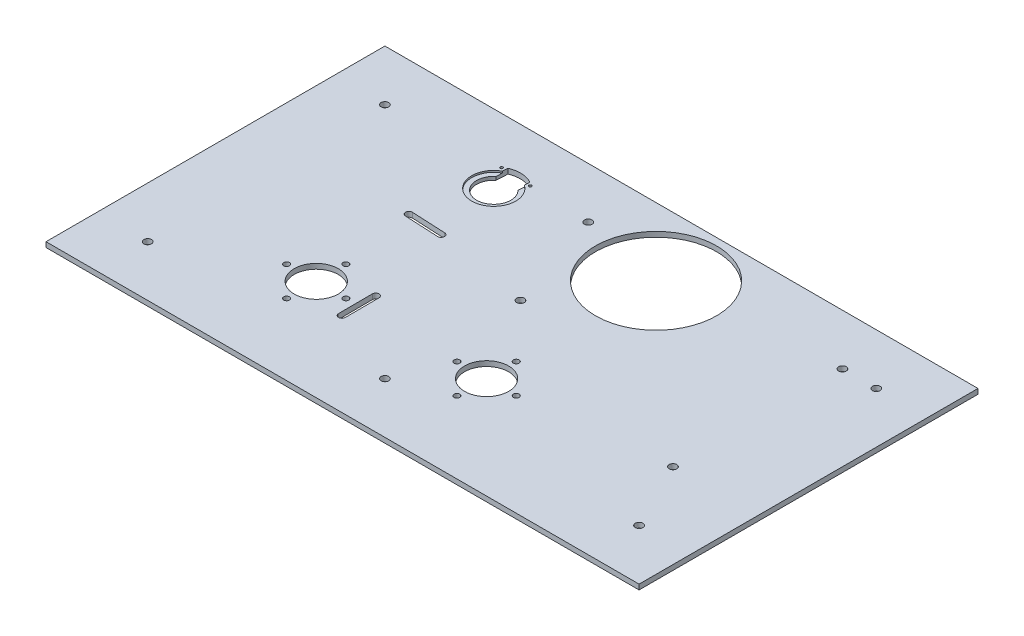
from build123d import *

# Parameters (mm, degrees)
SKETCH1_W                = 200
SKETCH1_H                = 200
BOSS_EXTRUDE1_DEPTH      = 3
SKETCH2_R                = 13
SKETCH2_R_2              = 35.7386452
SKETCH2_R_3              = 0.8
CUT_EXTRUDE1_DEPTH       = 283.85862193
M3_CLEARANCE_HOLE1_D     = 3.4
SKETCH5_R                = 13
CUT_EXTRUDE2_DEPTH       = 1
SKETCH6_W                = 50
SKETCH6_H                = 200
SKETCH6_W_2              = 100
BOSS_EXTRUDE2_DEPTH      = 3
M4_CLEARANCE_HOLE1_D     = 4.5
M4_CLEARANCE_HOLE1_DEPTH = 7
M4_CLEARANCE_HOLE1_TIP   = 1.351936393
M4_CLEARANCE_HOLE2_D     = 4.5
M4_CLEARANCE_HOLE2_DEPTH = 7
M4_CLEARANCE_HOLE2_TIP   = 1.351936393


with BuildPart() as part:
    # Sketch1 → Boss-Extrude1 (new body)
    with BuildSketch(Plane(origin=(0, 0, 0), x_dir=(1, 0, 0), z_dir=(0, 1, 0))):
        with Locations((100, 100)):
            Rectangle(SKETCH1_W, SKETCH1_H)
    extrude(amount=BOSS_EXTRUDE1_DEPTH)

    # Sketch2 → Cut-Extrude1 (cut, through all)
    with BuildSketch(Plane(origin=(0, 3, 0), x_dir=(1, 0, 0), z_dir=(0, 1, 0))):
        with Locations(Location((50.001332131, 59.483836796, 0), (0, 0, 270))):
            Circle(SKETCH2_R)
        with Locations(Location((150, 60, 0), (0, 0, 270))):
            Circle(SKETCH2_R)
        with Locations(Location((150, 160, 0), (0, 0, 270))):
            Circle(SKETCH2_R_2)
        with Locations(Location((46.591949224, 172.263872743, 0), (0, 0, 270))):
            Circle(SKETCH2_R_3)
        with Locations(Location((64.370811118, 171.396653192, 0), (0, 0, 90))):
            Circle(SKETCH2_R_3)
        with BuildLine():
            Line((73.052642061, 49.602687546), (72.949409421, 69.60242112))
            ThreePointArc((72.949409421, 69.60242112), (74.939059514, 71.612717742), (76.949356135, 69.623067648))
            Line((76.949356135, 69.623067648), (77.052588776, 49.623334074))
            ThreePointArc((77.052588776, 49.623334074), (75.062938683, 47.613037453), (73.052642061, 49.602687546))
        make_face()
        with BuildLine():
            Line((62.029703942, 166.504903281), (62.354703913, 173.16772538))
            ThreePointArc((62.354703913, 173.16772538), (55.639330891, 175.068409569), (48.770854376, 173.830320093))
            Line((48.770854376, 173.830320093), (48.445854405, 167.167497995))
            ThreePointArc((48.445854405, 167.167497995), (54.380843153, 149.268161339), (62.029703942, 166.504903281))
        make_face()
        with BuildLine():
            Line((62.877372778, 118.201780064), (42.901123459, 119.176184054))
            ThreePointArc((42.901123459, 119.176184054), (41.000938926, 121.271249385), (43.096004257, 123.171433918))
            Line((43.096004257, 123.171433918), (63.072253576, 122.197029928))
            ThreePointArc((63.072253576, 122.197029928), (64.972438109, 120.101964597), (62.877372778, 118.201780064))
        make_face()
    extrude(amount=-CUT_EXTRUDE1_DEPTH, mode=Mode.SUBTRACT)

    # M3 Clearance Hole1 (through all)
    with Locations(Plane(origin=(0, 3, 0), x_dir=(1, 0, 0), z_dir=(0, 1, 0))):
        with Locations((132.5, 60), (150, 77.5), (150, 42.5), (167.5, 60), (50.001332131, 76.983836796), (50.001332131, 41.983836796), (67.501332131, 59.483836796), (32.501332131, 59.483836796)):
            Hole(M3_CLEARANCE_HOLE1_D / 2)

    # Sketch5 → Cut-Extrude2 (cut)
    with BuildSketch(Plane(origin=(0, 3, 0), x_dir=(1, 0, 0), z_dir=(0, 1, 0))):
        with Locations((54.873352081, 159.365083393)):
            Circle(SKETCH5_R)
    extrude(amount=-CUT_EXTRUDE2_DEPTH, mode=Mode.SUBTRACT)

    # Sketch6 → Boss-Extrude2 (add)
    with BuildSketch(Plane(origin=(0, 3, 0), x_dir=(1, 0, 0), z_dir=(0, 1, 0))):
        with Locations((-25, 100)):
            Rectangle(SKETCH6_W, SKETCH6_H)
        with Locations((250, 100)):
            Rectangle(SKETCH6_W_2, SKETCH6_H)
    extrude(amount=-BOSS_EXTRUDE2_DEPTH)

    # M4 Clearance Hole1
    with Locations(Plane(origin=(0, 3, 0), x_dir=(1, 0, 0), z_dir=(0, 1, 0))):
        with Locations((100, 170), (250, 170), (250, 70)):
            Hole(M4_CLEARANCE_HOLE1_D / 2, depth=M4_CLEARANCE_HOLE1_DEPTH)
            with Locations((0, 0, -(M4_CLEARANCE_HOLE1_DEPTH + M4_CLEARANCE_HOLE1_TIP / 2))):  # 118° drill point
                Cone(0, M4_CLEARANCE_HOLE1_D / 2, M4_CLEARANCE_HOLE1_TIP, mode=Mode.SUBTRACT)

    # M4 Clearance Hole2
    with Locations(Plane(origin=(0, 3, 0), x_dir=(1, 0, 0), z_dir=(0, 1, 0))):
        with Locations((-20, 30), (270, 30), (-20, 170), (270, 170), (120, 110), (120, 30)):
            Hole(M4_CLEARANCE_HOLE2_D / 2, depth=M4_CLEARANCE_HOLE2_DEPTH)
            with Locations((0, 0, -(M4_CLEARANCE_HOLE2_DEPTH + M4_CLEARANCE_HOLE2_TIP / 2))):  # 118° drill point
                Cone(0, M4_CLEARANCE_HOLE2_D / 2, M4_CLEARANCE_HOLE2_TIP, mode=Mode.SUBTRACT)


solid = part.part
